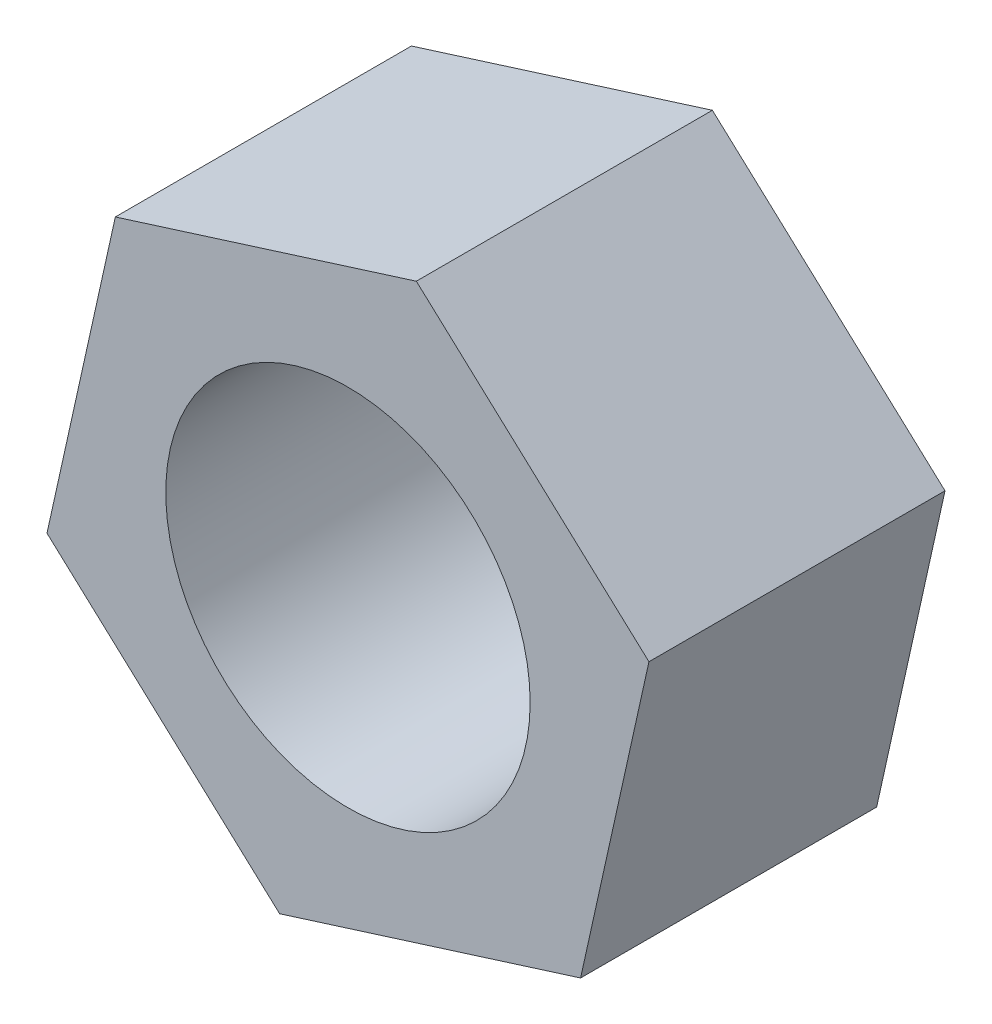
from build123d import *

# Parameters (mm, degrees)
EXTRUDE_1_DEPTH     = 13
SKETCH_2_R          = 8
CUT_EXTRUDE_1_DEPTH = 23.948843492


with BuildPart() as part:
    # ｽｹｯﾁ1 → ﾎﾞｽ - 押し出し1 (new body)
    with BuildSketch(Plane.XY):
        Polygon((10.214307391, -9.363115108), (13.215849238, 4.164292128), (3.001541847, 13.527407236), (-10.214307391, 9.363115108), (-13.215849238, -4.164292128), (-3.001541847, -13.527407236), align=None)
    extrude(amount=EXTRUDE_1_DEPTH)

    # ｽｹｯﾁ2 → ｶｯﾄ - 押し出し1 (cut, through all)
    with BuildSketch(Plane.XY.offset(13)):
        Circle(SKETCH_2_R)
    extrude(amount=-CUT_EXTRUDE_1_DEPTH, mode=Mode.SUBTRACT)


solid = part.part
